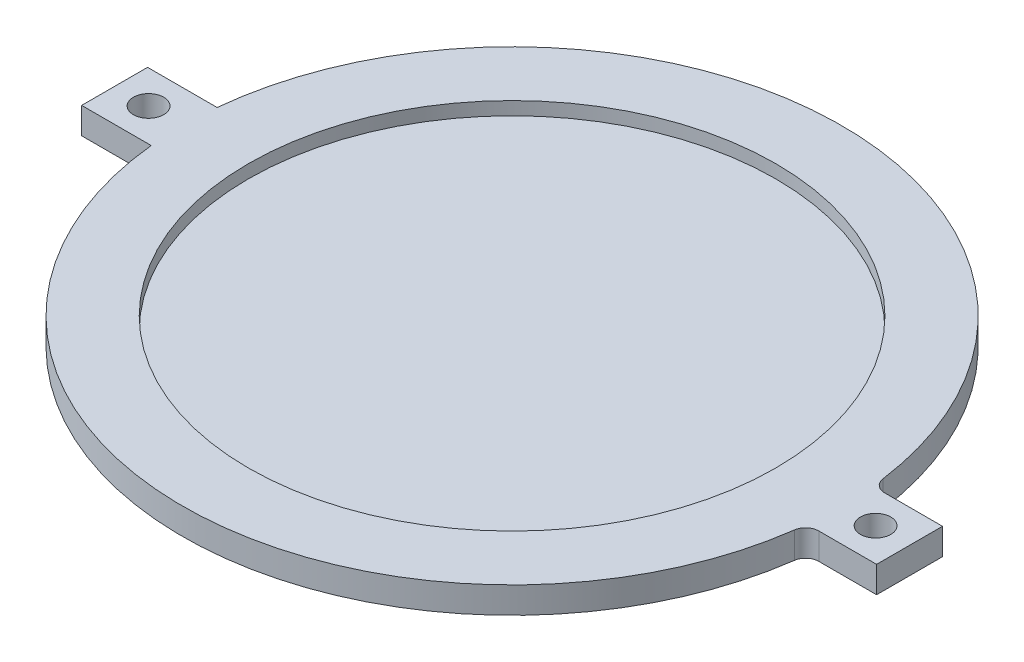
from build123d import *

# Parameters (mm, degrees)
CROQUIS1_R              = 25
CROQUIS1_W              = 10.3
CROQUIS1_H              = 5
CROQUIS1_R_2            = 1.15
SALIENTE_EXTRUIR1_DEPTH = 2
REDONDEO1_R             = 1
CROQUIS2_R              = 20
CORTAR_EXTRUIR1_DEPTH   = 1


with BuildPart() as part:
    # Croquis1 → Saliente-Extruir1 (new body)
    # profile 1 of 3: a face of its own
    with BuildSketch(Plane(origin=(0, 0, 0), x_dir=(1, 0, 0), z_dir=(0, 1, 0))):
        Circle(CROQUIS1_R)
    # profile 2 of 3: a face of its own
    with BuildSketch(Plane(origin=(0, 0, 0), x_dir=(1, 0, 0), z_dir=(0, 1, 0))):
        with Locations((25, 0)):
            Rectangle(CROQUIS1_W, CROQUIS1_H)
        with Locations(Location((27.575, 0, 0), (0, 0, 270))):
            Circle(CROQUIS1_R_2, mode=Mode.SUBTRACT)
    # profile 3 of 3: a face of its own
    with BuildSketch(Plane(origin=(0, 0, 0), x_dir=(1, 0, 0), z_dir=(0, 1, 0))):
        with Locations((-25, 0)):
            Rectangle(CROQUIS1_W, CROQUIS1_H)
        with Locations(Location((-27.575, 0, 0), (0, 0, 270))):
            Circle(CROQUIS1_R_2, mode=Mode.SUBTRACT)
    extrude(amount=SALIENTE_EXTRUIR1_DEPTH)

    # Redondeo1
    redondeo1_edges = [part.edges().sort_by_distance(p)[0] for p in [
        (24.874685928, 1, -2.5),
        (24.874685928, 1, 2.5),
    ]]
    fillet(redondeo1_edges, radius=REDONDEO1_R)

    # Croquis2 → Cortar-Extruir1 (cut)
    with BuildSketch(Plane(origin=(0, 2, 0), x_dir=(1, 0, 0), z_dir=(0, 1, 0))):
        with Locations(Location((0, 0, 0), (0, 0, 270))):
            Circle(CROQUIS2_R)
    extrude(amount=-CORTAR_EXTRUIR1_DEPTH, mode=Mode.SUBTRACT)


solid = part.part
